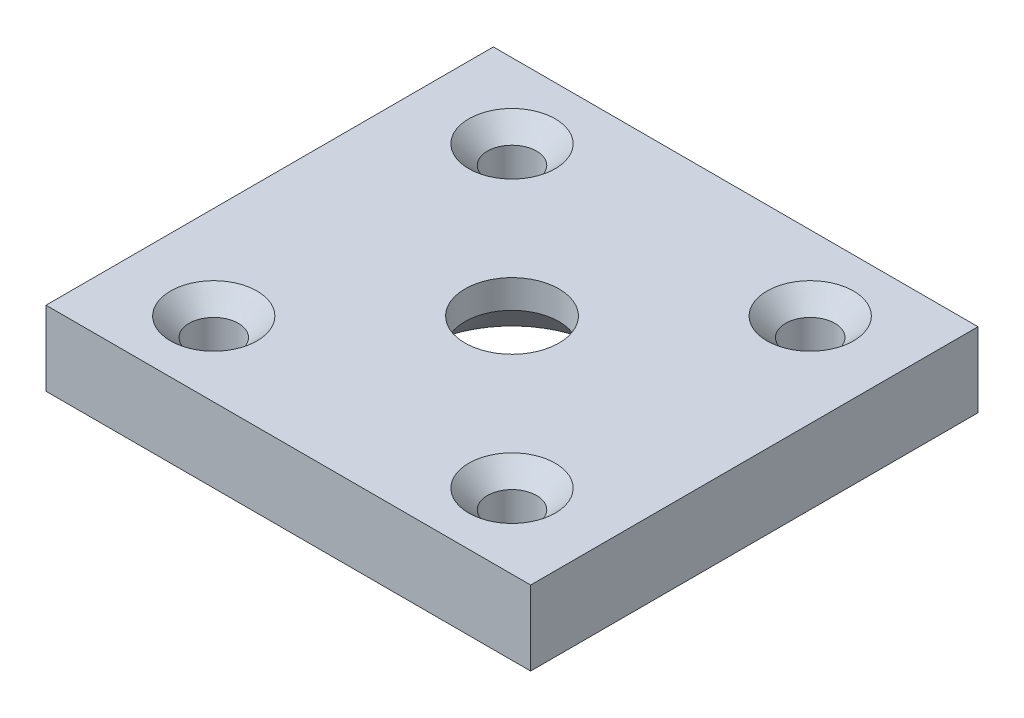
from build123d import *

# Parameters (mm, degrees)
SKETCH1_W                                           = 32.5
SKETCH1_H                                           = 30
BOSS_EXTRUDE1_DEPTH                                 = 5
CSK_FOR_M3_COUNTERSUNK_FLAT_HEAD_SCREW1_D           = 3.3
CSK_FOR_M3_COUNTERSUNK_FLAT_HEAD_SCREW1_CSINK_D     = 5.8
CSK_FOR_M3_COUNTERSUNK_FLAT_HEAD_SCREW1_CSINK_ANGLE = 90


with BuildPart() as part:
    # Sketch1 → Boss-Extrude1 (new body)
    with BuildSketch(Plane(origin=(0, 0, 0), x_dir=(1, 0, 0), z_dir=(0, 1, 0))):
        Rectangle(SKETCH1_W, SKETCH1_H)
    extrude(amount=BOSS_EXTRUDE1_DEPTH)

    # Sketch3 → CSK for M6 Hex Socket Countersunk Cap Screw1 (revolve, cut)
    with BuildSketch(Plane(origin=(0, 0, 0), x_dir=(0, 0, -1), z_dir=(1, 0, 0))):
        Polygon((0, 0), (0, 5), (3.15, 5), (3.15, 3.1), (6.25, 0), align=None)
    revolve(axis=Axis((0, -6.35, 0), (0, 1, 0)), mode=Mode.SUBTRACT)

    # CSK for M3 Countersunk Flat Head Screw1 (through all)
    with Locations(Plane(origin=(0, 5, 0), x_dir=(1, 0, 0), z_dir=(0, 1, 0))):
        with Locations((0, 0), (10, -10), (-10, 10), (-10, -10), (10, 10)):
            CounterSinkHole(CSK_FOR_M3_COUNTERSUNK_FLAT_HEAD_SCREW1_D / 2, CSK_FOR_M3_COUNTERSUNK_FLAT_HEAD_SCREW1_CSINK_D / 2, counter_sink_angle=CSK_FOR_M3_COUNTERSUNK_FLAT_HEAD_SCREW1_CSINK_ANGLE)


solid = part.part
